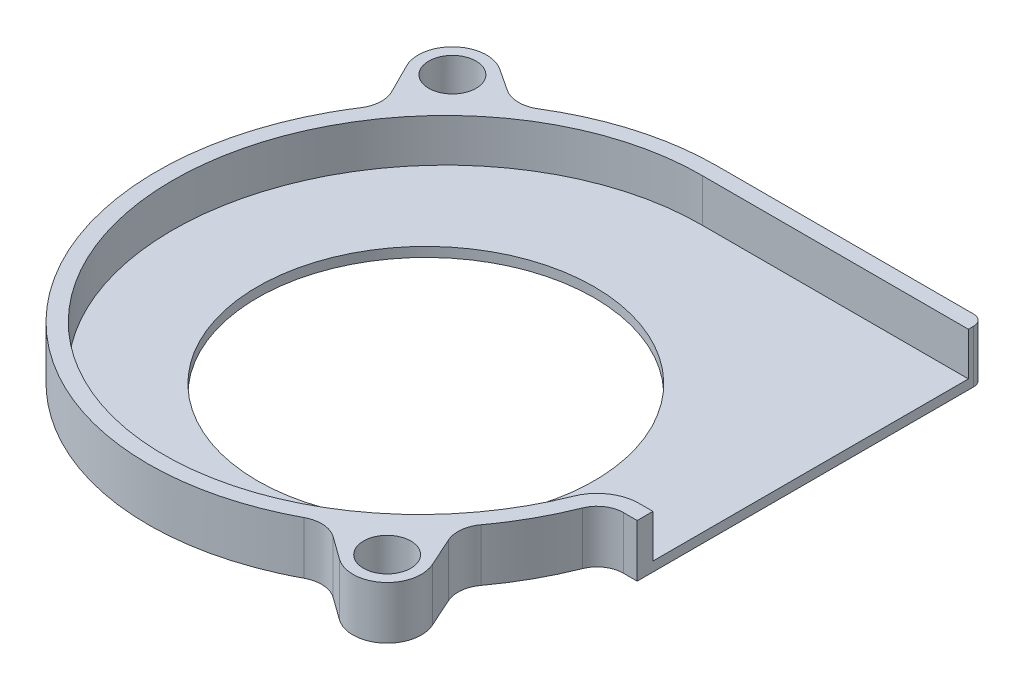
from build123d import *

# Parameters (mm, degrees)
SKETCH18_R          = 2.25
SKETCH18_R_2        = 16
BOSS_EXTRUDE2_DEPTH = 0.91
FILLET1_R           = 2.5
SKETCH22_R          = 2.25
BOSS_EXTRUDE3_DEPTH = 4.09


with BuildPart() as part:
    # Sketch18 → Boss-Extrude2 (new body)
    with BuildSketch(Plane(origin=(0, 0, 0), x_dir=(1, 0, 0), z_dir=(0, 1, 0))):
        with BuildLine():
            Line((-23.005700489, 21.173936517), (-21.582450949, 18.333239239))
            ThreePointArc((-21.582450949, 18.333239239), (-21.290226852, 16.922030245), (-21.738588357, 15.552403394))
            add(Edge.make_bspline(
                [(-21.738588357, 15.552403394), (-74.642199686, -65.790312539), (9.324862756, -20.895925284)],
                knots=[4.619035423, 4.619035423, 4.619035423, 7.234825226, 7.234825226, 7.234825226], degree=2, weights=[1, 0.259883374, 1]))
            ThreePointArc((9.324862756, -20.895925284), (10.831803609, -20.571378647), (12.282148638, -21.093586031))
            Line((12.282148638, -21.093586031), (14.423232763, -22.636631148))
            ThreePointArc((14.423232763, -22.636631148), (18.378398581, -22.5178413), (19.287328639, -18.666699414))
            Line((19.287328639, -18.666699414), (18.031066286, -15.874036932))
            ThreePointArc((18.031066286, -15.874036932), (17.800260945, -14.429576005), (18.329372436, -13.065838675))
            add(Edge.make_bspline(
                [(18.329372436, -13.065838675), (20.952057231, -9.501687367), (22.333293139, -5.3)],
                knots=[1.416240338, 1.416240338, 1.416240338, 1.752231262, 1.752231262, 1.752231262], degree=2, weights=[1, 0.985921919, 1]))
            Line((22.333293139, -5.3), (25.4, -5.3))
            Line((25.4, -5.3), (25.4, 26.7))
            ThreePointArc((25.4, 26.7), (25.107106781, 27.407106781), (24.4, 27.7))
            Line((24.4, 27.7), (-0.010581904, 27.7))
            add(Edge.make_bspline(
                [(-0.010581904, 27.7), (-7.028971285, 27.7), (-13.197915422, 23.907683644)],
                knots=[3.605852843, 3.605852843, 3.605852843, 4.154921422, 4.154921422, 4.154921422], degree=2, weights=[1, 0.962551555, 1]))
            ThreePointArc((-13.197915422, 23.907683644), (-14.708437667, 23.493357847), (-16.205141277, 23.955117118))
            Line((-16.205141277, 23.955117118), (-18.311498324, 25.343379249))
            ThreePointArc((-18.311498324, 25.343379249), (-22.258262373, 25.059651887), (-23.005700489, 21.173936517))
        make_face()
        with Locations(Location((16.3234107, -20, 0), (0, 0, 270))):
            Circle(SKETCH18_R, mode=Mode.SUBTRACT)
        with Locations(Location((-20.1, 22.629754043, 0), (0, 0, 270))):
            Circle(SKETCH18_R, mode=Mode.SUBTRACT)
        with Locations(Location((0, 0, 0), (0, 0, 270))):
            Circle(SKETCH18_R_2, mode=Mode.SUBTRACT)
    extrude(amount=BOSS_EXTRUDE2_DEPTH)

    # Fillet1
    fillet1_edges = [part.edges().sort_by_distance(p)[0] for p in [
        (22.333293139, 0.455, 5.3),
    ]]
    fillet(fillet1_edges, radius=FILLET1_R)

    # Sketch22 → Boss-Extrude3 (add)
    with BuildSketch(Plane(origin=(0, 0.91, 0), x_dir=(-1, 0, 0), z_dir=(0, -1, 0))):
        with BuildLine():
            Line((0.010581904, 27.7), (-24.4, 27.7))
            ThreePointArc((-24.4, 27.7), (-25.107106781, 27.407106781), (-25.4, 26.7))
            Line((-25.4, 26.7), (-25.4, 26.2))
            Line((-25.4, 26.2), (-0.134529672, 26.2))
            add(Edge.make_bspline(
                [(-20.367528733, -6.322552603), (-2.799285505, -50.52288462), (21.15759874, -12.014553468), (45.114482985, 26.493777684), (-0.134529672, 26.2)],
                knots=[1.453228322, 1.453228322, 1.453228322, 3.639957949, 3.639957949, 5.826687576, 5.826687576, 5.826687576], degree=2, weights=[1, 0.45949942, 1, 0.45949942, 1]))
            ThreePointArc((-20.367528733, -6.322552603), (-21.83854018, -4.49018206), (-24.084671344, -3.8))
            Line((-24.084671344, -3.8), (-25.4, -3.8))
            Line((-25.4, -3.8), (-25.4, -5.3))
            Line((-25.4, -5.3), (-24.084632068, -5.3))
            ThreePointArc((-24.084632068, -5.3), (-22.680778329, -5.731378556), (-21.761398508, -6.876644257))
            add(Edge.make_bspline(
                [(-21.761398508, -6.876644257), (-20.443306322, -10.193064851), (-18.329372436, -13.065838675)],
                knots=[4.595237109, 4.595237109, 4.595237109, 4.866944969, 4.866944969, 4.866944969], degree=2, weights=[1, 0.990786039, 1]))
            ThreePointArc((-18.329372436, -13.065838675), (-17.800260945, -14.429576005), (-18.031066286, -15.874036932))
            Line((-18.031066286, -15.874036932), (-19.287328639, -18.666699414))
            ThreePointArc((-19.287328639, -18.666699414), (-18.378398581, -22.5178413), (-14.423232763, -22.636631148))
            Line((-14.423232763, -22.636631148), (-12.282148638, -21.093586031))
            ThreePointArc((-12.282148638, -21.093586031), (-10.831803609, -20.571378647), (-9.324862756, -20.895925284))
            add(Edge.make_bspline(
                [(-9.324862756, -20.895925284), (74.642199686, -65.790312539), (21.738588357, 15.552403394)],
                knots=[5.331545389, 5.331545389, 5.331545389, 7.947335192, 7.947335192, 7.947335192], degree=2, weights=[1, 0.259883374, 1]))
            ThreePointArc((21.738588357, 15.552403394), (21.290226852, 16.922030245), (21.582450949, 18.333239239))
            Line((21.582450949, 18.333239239), (23.005700489, 21.173936517))
            ThreePointArc((23.005700489, 21.173936517), (22.258262373, 25.059651887), (18.311498324, 25.343379249))
            Line((18.311498324, 25.343379249), (16.205141277, 23.955117118))
            ThreePointArc((16.205141277, 23.955117118), (14.708437667, 23.493357847), (13.197915422, 23.907683644))
            add(Edge.make_bspline(
                [(13.197915422, 23.907683644), (7.028971285, 27.7), (0.010581904, 27.7)],
                knots=[2.128263885, 2.128263885, 2.128263885, 2.677332464, 2.677332464, 2.677332464], degree=2, weights=[1, 0.962551555, 1]))
        make_face()
        with Locations(Location((20.1, 22.629754043, 0), (0, 0, 90))):
            Circle(SKETCH22_R, mode=Mode.SUBTRACT)
        with Locations(Location((-16.3234107, -20, 0), (0, 0, 90))):
            Circle(SKETCH22_R, mode=Mode.SUBTRACT)
    extrude(amount=-BOSS_EXTRUDE3_DEPTH)


solid = part.part
